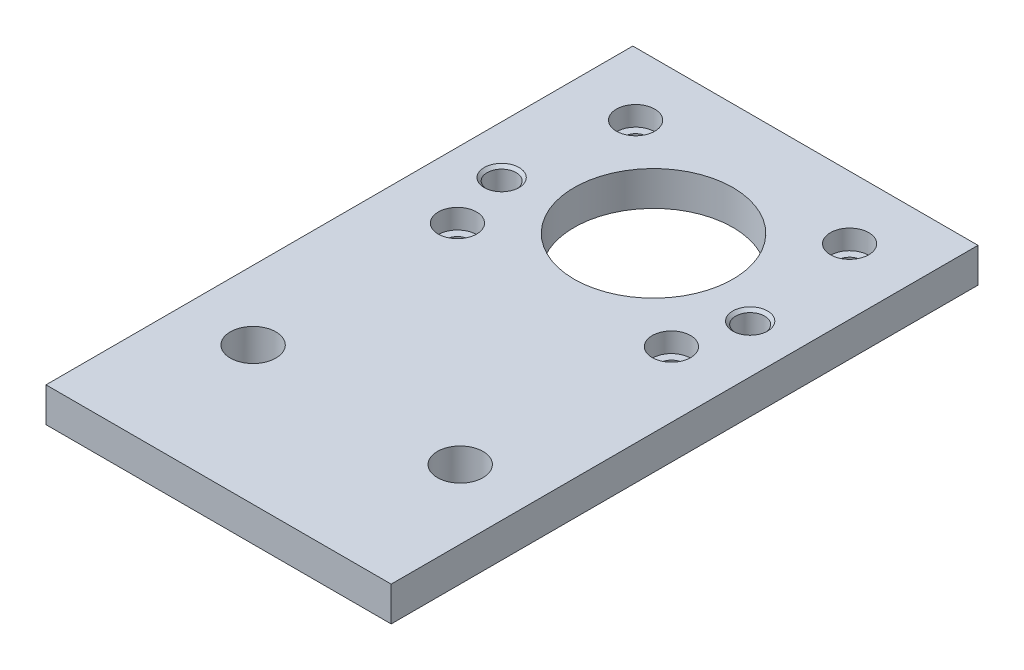
from build123d import *

# Parameters (mm, degrees)
SKETCH1_W                                      = 50
SKETCH1_H                                      = 85
SKETCH1_R                                      = 11.5
BOSS_EXTRUDE1_DEPTH                            = 5
CBORE_FOR_4_SOCKET_HEAD_CAP_SCREW1_D           = 3.2639
CBORE_FOR_4_SOCKET_HEAD_CAP_SCREW1_CBORE_D     = 5.55752
CBORE_FOR_4_SOCKET_HEAD_CAP_SCREW1_CBORE_DEPTH = 2.8448
M6_CLEARANCE_HOLE1_D                           = 6.6
M5_TAPPED_HOLE1_D                              = 4.2
M5_TAPPED_HOLE1_CSINK_D                        = 5.05
M5_TAPPED_HOLE1_CSINK_ANGLE                    = 90


with BuildPart() as part:
    # Sketch1 → Boss-Extrude1 (new body)
    with BuildSketch(Plane(origin=(0, 0, 0), x_dir=(1, 0, 0), z_dir=(0, 1, 0))):
        with Locations((25, 42.5)):
            Rectangle(SKETCH1_W, SKETCH1_H)
        with Locations(Location((25, 63, 0), (0, 0, 270))):
            Circle(SKETCH1_R, mode=Mode.SUBTRACT)
    extrude(amount=BOSS_EXTRUDE1_DEPTH)

    # CBORE for #4 Socket Head Cap Screw1 (through all)
    with Locations(Plane(origin=(0, 5, 0), x_dir=(-1, 0, 0), z_dir=(0, 1, 0))):
        with Locations((-9.5, -75.903324015), (-9.5, -50.096675985), (-40.5, -50.096675985), (-40.5, -75.903324015)):
            CounterBoreHole(CBORE_FOR_4_SOCKET_HEAD_CAP_SCREW1_D / 2, CBORE_FOR_4_SOCKET_HEAD_CAP_SCREW1_CBORE_D / 2, CBORE_FOR_4_SOCKET_HEAD_CAP_SCREW1_CBORE_DEPTH)

    # M6 Clearance Hole1 (through all)
    with Locations(Plane(origin=(0, 5, 0), x_dir=(-1, 0, 0), z_dir=(0, 1, 0))):
        with Locations((-10, -20), (-40, -20)):
            Hole(M6_CLEARANCE_HOLE1_D / 2)

    # M5 Tapped Hole1 (through all)
    with Locations(Plane(origin=(0, 5, 0), x_dir=(-1, 0, 0), z_dir=(0, 1, 0))):
        with Locations((-7, -59), (-43, -59)):
            CounterSinkHole(M5_TAPPED_HOLE1_D / 2, M5_TAPPED_HOLE1_CSINK_D / 2, counter_sink_angle=M5_TAPPED_HOLE1_CSINK_ANGLE)


solid = part.part
